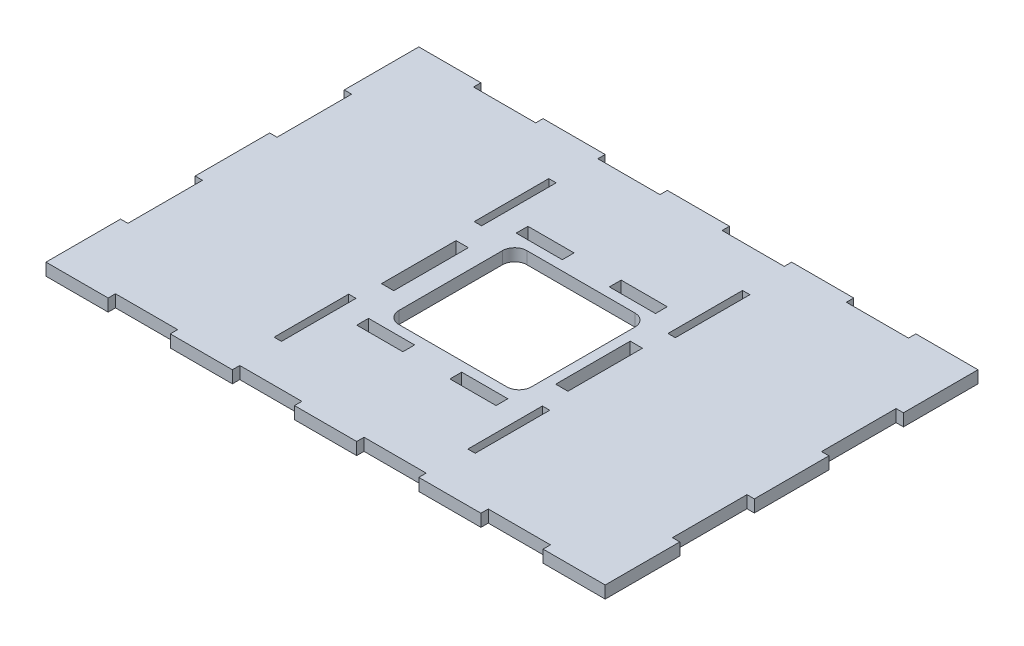
from build123d import *

# Parameters (mm, degrees)
SKETCH1_W           = 3
SKETCH1_H           = 30.4
SKETCH1_W_2         = 18.8
SKETCH1_H_2         = 4.8
BOSS_EXTRUDE1_DEPTH = 5
CUT_EXTRUDE1_DEPTH  = 138.102151697


with BuildPart() as part:
    # Sketch1 → Boss-Extrude1 (new body)
    with BuildSketch(Plane(origin=(0, 0, 0), x_dir=(1, 0, 0), z_dir=(0, 1, 0))):
        Polygon((-114, 0), (-114, 15.2), (-111, 15.2), (-111, 45.6), (-114, 45.6), (-114, 76), (-88.666666667, 76), (-88.666666667, 73), (-63.333333333, 73), (-63.333333333, 76), (-38, 76), (-38, 73), (-12.666666667, 73), (-12.666666667, 76), (0, 76), (0, 0), (-33, 0), (-33, 15.2), (-38, 15.2), (-38, 0), align=None)
        with Locations((-39.5, 40.8)):
            Rectangle(SKETCH1_W, SKETCH1_H, mode=Mode.SUBTRACT)
        with Locations((-19, 32.5)):
            Rectangle(SKETCH1_W_2, SKETCH1_H_2, mode=Mode.SUBTRACT)
    boss_extrude1 = extrude(amount=BOSS_EXTRUDE1_DEPTH)

    # Mirror1: Boss-Extrude1 across plane
    add(boss_extrude1.mirror(Plane(origin=(-114, 5, 0), x_dir=(1, 0, 0), z_dir=(0, 0, -1))))

    # Mirror6: part across plane


with BuildPart() as part_1:
    add(part.part)
    add(part.part.mirror(Plane(origin=(0, 5, 0), x_dir=(0, 0, 1), z_dir=(-1, 0, 0))))

    # Sketch2 → Cut-Extrude1 (cut, through all)
    with BuildSketch(Plane(origin=(0, 5, 0), x_dir=(1, 0, 0), z_dir=(0, 1, 0))):
        with BuildLine():
            Line((24, 26.1), (-20, 26.1))
            ThreePointArc((-20, 26.1), (-23.535533906, 24.635533906), (-25, 21.1))
            Line((-25, 21.1), (-25, -21.1))
            ThreePointArc((-25, -21.1), (-23.535533906, -24.635533906), (-20, -26.1))
            Line((-20, -26.1), (24, -26.1))
            ThreePointArc((24, -26.1), (27.535533906, -24.635533906), (29, -21.1))
            Line((29, -21.1), (29, 21.1))
            ThreePointArc((29, 21.1), (27.535533906, 24.635533906), (24, 26.1))
        make_face()
    extrude(amount=-CUT_EXTRUDE1_DEPTH, mode=Mode.SUBTRACT)


solid = part_1.part
